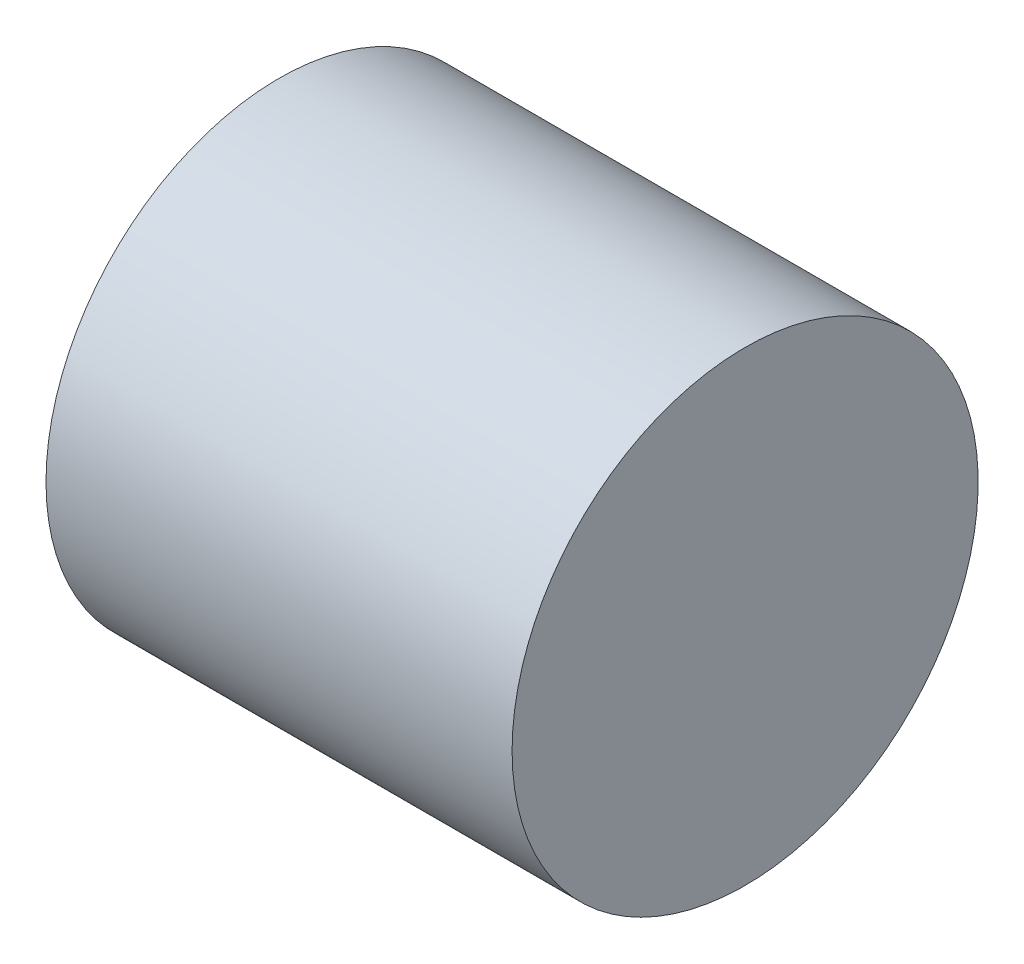
from build123d import *

# Parameters (mm, degrees)
ESQUISSE1_W = 7
ESQUISSE1_H = 3.5


with BuildPart() as part:
    # Esquisse1 → Base-Révolution (revolve)
    with BuildSketch(Plane.XY, mode=Mode.PRIVATE) as base_r_volution_sk:
        with Locations((-0.976181968, 21.75)):
            Rectangle(ESQUISSE1_W, ESQUISSE1_H)
    revolve(base_r_volution_sk.sketch.rotate(Axis((-6.355206561, 23.5, 0), (1, 0, 0)), 270), axis=Axis((-6.355206561, 23.5, 0), (1, 0, 0)))


solid = part.part
